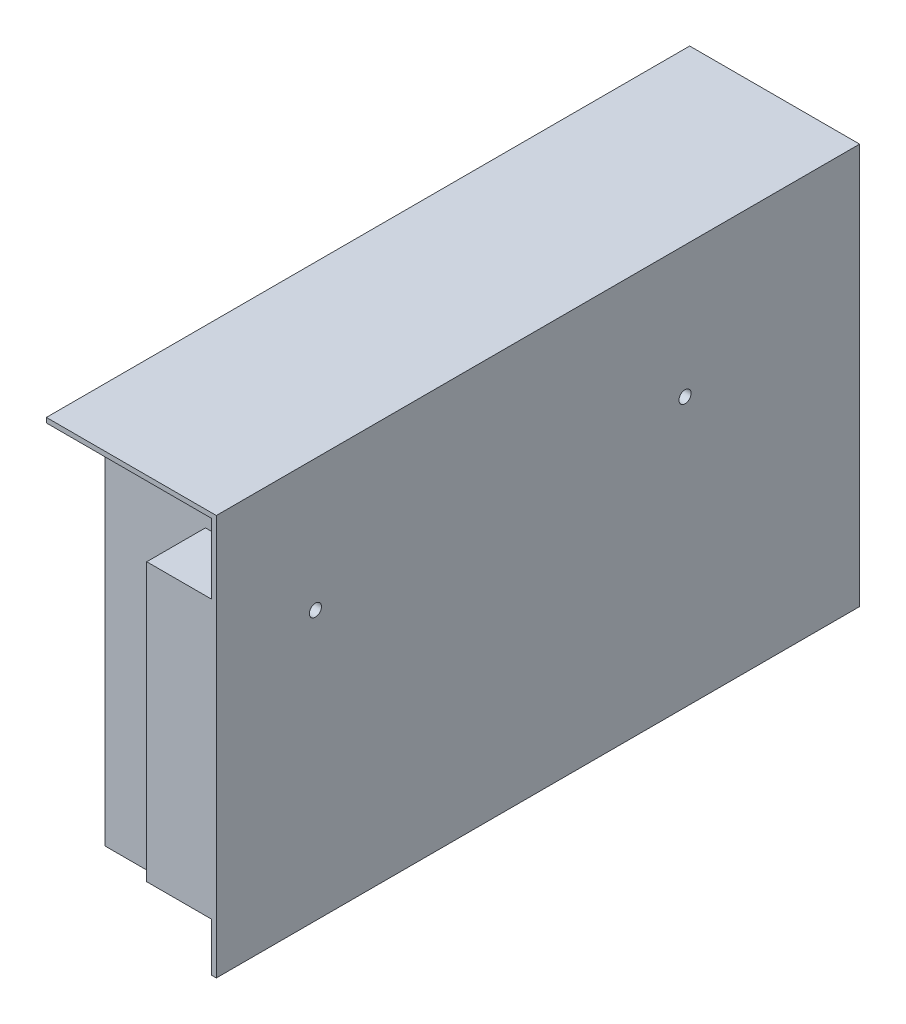
from build123d import *

# Parameters (mm, degrees)
SKETCH1_W           = 159
SKETCH1_H           = 99
BOSS_EXTRUDE1_DEPTH = 42
SKETCH2_W           = 14.5
SKETCH2_H           = 97.8
CUT_EXTRUDE1_DEPTH  = 40.8
SKETCH3_W           = 14.5
SKETCH3_H           = 68.5
BOSS_EXTRUDE2_DEPTH = 16
SKETCH5_R           = 1.5
CUT_EXTRUDE2_DEPTH  = 5


with BuildPart() as part:
    # Sketch1 → Boss-Extrude1 (new body)
    with BuildSketch(Plane(origin=(0, 0, 0), x_dir=(0, 0, -1), z_dir=(1, 0, 0))):
        with Locations((22.6575, -29.7045)):
            Rectangle(SKETCH1_W, SKETCH1_H)
    extrude(amount=BOSS_EXTRUDE1_DEPTH)

    # Sketch2 → Cut-Extrude1 (cut)
    with BuildSketch(Plane.ZY):
        with Locations((49.5925, -30.3045)):
            Rectangle(SKETCH2_W, SKETCH2_H)
    extrude(amount=-CUT_EXTRUDE1_DEPTH, mode=Mode.SUBTRACT)

    # Sketch3 → Boss-Extrude2 (add)
    with BuildSketch(Plane.ZY.offset(-40.8)):
        with Locations((49.5925, -32.9545)):
            Rectangle(SKETCH3_W, SKETCH3_H)
    extrude(amount=BOSS_EXTRUDE2_DEPTH)

    # Sketch5 → Cut-Extrude2 (cut)
    with BuildSketch(Plane(origin=(42, 0, 0), x_dir=(0, 0, -1), z_dir=(1, 0, 0))):
        with Locations((-32.3425, -12.7045)):
            Circle(SKETCH5_R)
        with Locations((59.009480141, -12.7045)):
            Circle(SKETCH5_R)
    extrude(amount=-CUT_EXTRUDE2_DEPTH, mode=Mode.SUBTRACT)


solid = part.part
